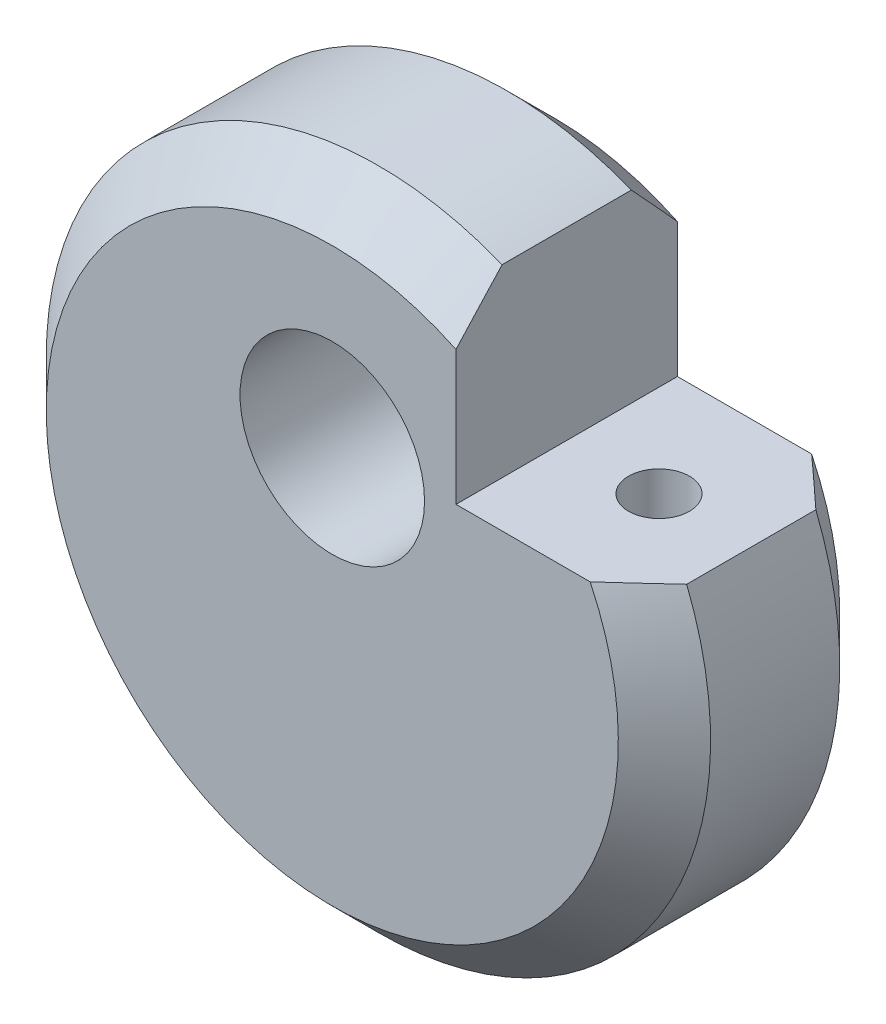
from build123d import *

# Parameters (mm, degrees)
SKETCH1_R             = 18
BOSS_EXTRUDE1_DEPTH   = 12
CUT_EXTRUDE4_DEPTH    = 17
SKETCH1_5_R           = 5
CUT_EXTRUDE5_DEPTH    = 22
M4_TAPPED_HOLE1_D     = 3.3
M4_TAPPED_HOLE1_DEPTH = 14
M4_TAPPED_HOLE1_TIP   = 0.991420021
CHAMFER1_SIZE         = 2.5
CHAMFER2_SIZE         = 2.5


with BuildPart() as part:
    # Sketch1 → Boss-Extrude1 (new body)
    with BuildSketch(Plane.XY):
        Circle(SKETCH1_R)
    extrude(amount=-BOSS_EXTRUDE1_DEPTH)

    # Sketch1<4> → Cut-Extrude4 (cut)
    with BuildSketch(Plane.XY):
        with BuildLine():
            Line((16.704699911, 6.704699911), (6.704699911, 6.704699911))
            Line((6.704699911, 6.704699911), (6.704699911, 16.704699911))
            ThreePointArc((6.704699911, 16.704699911), (12.727922061, 12.727922061), (16.704699911, 6.704699911))
        make_face()
    extrude(amount=-CUT_EXTRUDE4_DEPTH, mode=Mode.SUBTRACT)

    # Sketch1<5> → Cut-Extrude5 (cut)
    with BuildSketch(Plane.XY):
        with Locations((0, 6)):
            Circle(SKETCH1_5_R)
    extrude(amount=-CUT_EXTRUDE5_DEPTH, mode=Mode.SUBTRACT)

    # M4 Tapped Hole1
    with Locations(Plane(origin=(0, 6.704699911, 0), x_dir=(1, 0, 0), z_dir=(0, 1, 0))):
        with Locations((11.704699911, 6)):
            Hole(M4_TAPPED_HOLE1_D / 2, depth=M4_TAPPED_HOLE1_DEPTH)
            with Locations((0, 0, -(M4_TAPPED_HOLE1_DEPTH + M4_TAPPED_HOLE1_TIP / 2))):  # 118° drill point
                Cone(0, M4_TAPPED_HOLE1_D / 2, M4_TAPPED_HOLE1_TIP, mode=Mode.SUBTRACT)

    # Chamfer1
    chamfer1_edges = [part.edges().sort_by_distance(p)[0] for p in [
        (-12.727922061, -12.727922061, 0),
    ]]
    chamfer(chamfer1_edges, length=CHAMFER1_SIZE)

    # Chamfer2
    chamfer2_edges = [part.edges().sort_by_distance(p)[0] for p in [
        (-12.727922061, -12.727922061, -12),
    ]]
    chamfer(chamfer2_edges, length=CHAMFER2_SIZE)


solid = part.part
